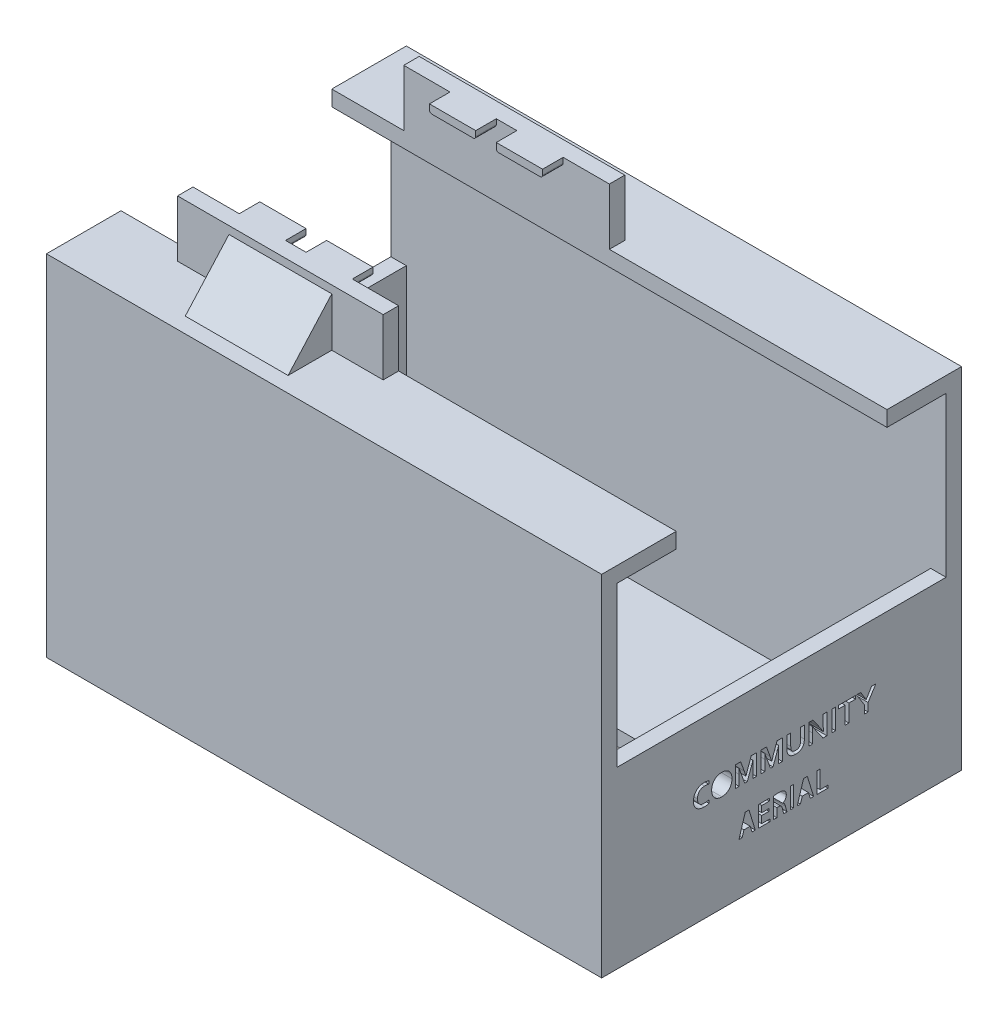
from build123d import *

# Parameters (mm, degrees)
CROQUIS1_W              = 40
CROQUIS1_H              = 47
CROQUIS1_W_2            = 15
CROQUIS1_H_2            = 41
SALIENTE_EXTRUIR1_DEPTH = 3
CROQUIS3_W              = 40
CROQUIS3_H              = 3
SALIENTE_EXTRUIR2_DEPTH = 5
SALIENTE_EXTRUIR3_DEPTH = 4
CROQUIS6_W              = 40
CROQUIS6_H              = 3
SALIENTE_EXTRUIR4_DEPTH = 3
SALIENTE_EXTRUIR5_DEPTH = 54
CROQUIS9_W              = 3
CROQUIS9_H              = 34
SALIENTE_EXTRUIR6_DEPTH = 34
CROQUIS10_W             = 41
CROQUIS10_H             = 6
CORTAR_EXTRUIR1_DEPTH   = 34
NERVIO1_REACH           = 110.361
CROQUIS11_WALL_W        = 231.468567608
CROQUIS11_WALL_H        = 20
CROQUIS12_W             = 60
CROQUIS12_H             = 11
CORTAR_EXTRUIR2_DEPTH   = 68
CROQUIS13_W             = 0.732394367
CROQUIS13_H             = 4
CROQUIS13_W_2           = 0.61236876
CORTAR_EXTRUIR4_DEPTH   = 4
CROQUIS14_R             = 1.733929614
CROQUIS14_R_2           = 0.97438497
CORTAR_EXTRUIR5_DEPTH   = 4


with BuildPart() as part:
    # Croquis1 → Saliente-Extruir1 (new body)
    with BuildSketch(Plane(origin=(0, 0, 0), x_dir=(1, 0, 0), z_dir=(0, 1, 0))):
        Rectangle(CROQUIS1_W, CROQUIS1_H)
        with Locations((-9.5, 0)):
            Rectangle(CROQUIS1_W_2, CROQUIS1_H_2, mode=Mode.SUBTRACT)
        with Locations((9.5, 0)):
            Rectangle(CROQUIS1_W_2, CROQUIS1_H_2, mode=Mode.SUBTRACT)
    extrude(amount=SALIENTE_EXTRUIR1_DEPTH)

    # Croquis3 → Saliente-Extruir2 (add)
    with BuildSketch(Plane(origin=(0, 3, 0), x_dir=(1, 0, 0), z_dir=(0, 1, 0))):
        with Locations((0, 22)):
            Rectangle(CROQUIS3_W, CROQUIS3_H)
        with Locations((0, -22)):
            Rectangle(CROQUIS3_W, CROQUIS3_H)
    extrude(amount=SALIENTE_EXTRUIR2_DEPTH)

    # Croquis5 → Saliente-Extruir3 (add)
    with BuildSketch(Plane.XY.offset(-20.5)):
        with BuildLine():
            Line((-10.5, 6.5), (-2.5, 6.5))
            ThreePointArc((-2.5, 6.5), (-2.146446609, 6.646446609), (-2, 7))
            Line((-2, 7), (-2, 8))
            Line((-2, 8), (-11, 8))
            Line((-11, 8), (-11, 7))
            ThreePointArc((-11, 7), (-10.853553391, 6.646446609), (-10.5, 6.5))
        make_face()
        with BuildLine():
            Line((2, 7), (2, 8))
            Line((2, 8), (11, 8))
            Line((11, 8), (11, 7))
            ThreePointArc((11, 7), (10.853553391, 6.646446609), (10.5, 6.5))
            Line((10.5, 6.5), (2.5, 6.5))
            ThreePointArc((2.5, 6.5), (2.146446609, 6.646446609), (2, 7))
        make_face()
    saliente_extruir3 = extrude(amount=SALIENTE_EXTRUIR3_DEPTH)

    # Simetría3: Saliente-Extruir3 across plane
    add(saliente_extruir3.mirror(Plane.XY))

    # Croquis6 → Saliente-Extruir4 (add)
    with BuildSketch(Plane.XZ):
        with Locations((0, 22)):
            Rectangle(CROQUIS6_W, CROQUIS6_H)
        with Locations((0, -22)):
            Rectangle(CROQUIS6_W, CROQUIS6_H)
    extrude(amount=SALIENTE_EXTRUIR4_DEPTH)

    # Croquis8 → Saliente-Extruir5 (add, symmetric)
    with BuildSketch(Plane(origin=(20, 0, 0), x_dir=(0, 0, -1), z_dir=(1, 0, 0))):
        Polygon((-32, -68), (32, -68), (32, -6), (20.5, -6), (20.5, -3), (35, -3), (35, -71), (-35, -71), (-35, -3), (-20.5, -3), (-20.5, -6), (-32, -6), align=None)
    extrude(amount=SALIENTE_EXTRUIR5_DEPTH, both=True)

    # Croquis9 → Saliente-Extruir6 (add, symmetric)
    with BuildSketch(Plane.XY):
        with Locations((-32.5, -54)):
            Rectangle(CROQUIS9_W, CROQUIS9_H)
        with Locations((72.5, -54)):
            Rectangle(CROQUIS9_W, CROQUIS9_H)
    extrude(amount=SALIENTE_EXTRUIR6_DEPTH, both=True)

    # Croquis10 → Cortar-Extruir1 (cut, symmetric)
    with BuildSketch(Plane(origin=(0, 0, 0), x_dir=(0, 0, -1), z_dir=(1, 0, 0))):
        Rectangle(CROQUIS10_W, CROQUIS10_H)
    extrude(amount=CORTAR_EXTRUIR1_DEPTH, both=True, mode=Mode.SUBTRACT)

    # Croquis11 wall → Nervio1 (add, up to next)
    with BuildSketch(Plane(origin=(0, 1.75, 27.75), x_dir=(0, 0.745241313525, -0.66679485947), z_dir=(0, 0.66679485947, 0.745241313525)), mode=Mode.PRIVATE) as nervio1_sk1:
        Rectangle(CROQUIS11_WALL_W, CROQUIS11_WALL_H)
    nervio1_tool1 = extrude(nervio1_sk1.sketch, amount=-NERVIO1_REACH, mode=Mode.PRIVATE) - part.part
    nervio1 = nervio1_tool1.solids().sort_by_distance((0, 1.75, 27.75))[0]
    add(nervio1)

    # Simetría4: Nervio1 across plane
    add(nervio1.mirror(Plane.XY))

    # Croquis12 → Cortar-Extruir2 (cut)
    with BuildSketch(Plane.XZ.offset(71)):
        with Locations((41, 0)):
            Rectangle(CROQUIS12_W, CROQUIS12_H)
    extrude(amount=-CORTAR_EXTRUIR2_DEPTH, mode=Mode.SUBTRACT)

    # Croquis13 → Cortar-Extruir4 (cut)
    # profile 1 of 15: a face of its own
    with BuildSketch(Plane(origin=(74, 0, 0), x_dir=(0, 0, -1), z_dir=(1, 0, 0))):
        with BuildLine():
            add(Edge.make_bspline(
                [(-15.00528169, -48.663980677), (-15.053765048, -48.665095606), (-15.149332112, -48.667293277), (-15.289739865, -48.686764888), (-15.425107119, -48.7157554), (-15.553314123, -48.759459851), (-15.67476296, -48.813029916), (-15.787922302, -48.878013337), (-15.891314702, -48.955465504), (-15.986458663, -49.042759882), (-16.07089505, -49.142399254), (-16.147179307, -49.251624371), (-16.212352909, -49.372635659), (-16.267957213, -49.503917295), (-16.311743239, -49.645788681), (-16.343268641, -49.797542257), (-16.363129276, -49.958934568), (-16.365157029, -50.070024337), (-16.366197183, -50.127008846)],
                knots=[0, 0, 0, 0, 1.0311898, 2.032610485, 3.011249611, 3.972848753, 4.909243392, 5.832429518, 6.742815144, 7.653029452, 8.57410157, 9.516348602, 10.483103376, 11.493207285, 12.545856977, 13.636989185, 14.787872092, 16, 16, 16, 16], degree=3))
            add(Edge.make_bspline(
                [(-16.366197183, -50.127008846), (-16.364915717, -50.183384183), (-16.362427005, -50.292869736), (-16.346044285, -50.451977108), (-16.31704449, -50.6004457), (-16.276753418, -50.738127731), (-16.225416491, -50.865240928), (-16.163848626, -50.981336445), (-16.093125912, -51.08753053), (-16.011792624, -51.182063329), (-15.920237101, -51.265840018), (-15.818554305, -51.337468246), (-15.708510866, -51.400417198), (-15.588069842, -51.449726174), (-15.459517163, -51.490007217), (-15.321804188, -51.516065145), (-15.176578157, -51.53495803), (-15.076650984, -51.536454512), (-15.025528169, -51.537220114)],
                knots=[0, 0, 0, 0, 1.221355031, 2.371972145, 3.460356745, 4.49426383, 5.475241926, 6.425055258, 7.336592403, 8.233650564, 9.120104613, 10.017973287, 10.92317089, 11.860586024, 12.831793425, 13.836642003, 14.893224465, 16, 16, 16, 16], degree=3))
            add(Edge.make_bspline(
                [(-15.025528169, -51.537220114), (-14.949482973, -51.535822116), (-14.795934247, -51.532999311), (-14.56630306, -51.511329216), (-14.341700538, -51.476991191), (-14.19639141, -51.44167918), (-14.125880282, -51.424544057)],
                knots=[0, 0, 0, 0, 1.003734523, 2.026717865, 3.042466559, 4, 4, 4, 4], degree=3))
            Line((-14.125880282, -51.424544057), (-14.125880282, -52.032818705))
            add(Edge.make_bspline(
                [(-14.125880282, -52.032818705), (-14.197547453, -52.0511587), (-14.345656584, -52.089060582), (-14.577606191, -52.127062811), (-14.821896406, -52.152878899), (-14.988486495, -52.155571437), (-15.07306338, -52.156938423)],
                knots=[0, 0, 0, 0, 0.926191764, 1.91409057, 2.940995081, 4, 4, 4, 4], degree=3))
            add(Edge.make_bspline(
                [(-15.07306338, -52.156938423), (-15.154719597, -52.15543498), (-15.313527623, -52.152511028), (-15.544123458, -52.124523309), (-15.759918117, -52.080195269), (-15.960615959, -52.01796667), (-16.145855315, -51.937703738), (-16.317461435, -51.843968225), (-16.474010961, -51.733861382), (-16.616603503, -51.610618885), (-16.74322833, -51.472312481), (-16.853356857, -51.320805466), (-16.946649023, -51.15591068), (-17.023015887, -50.979132345), (-17.081777498, -50.790739091), (-17.123803062, -50.592709969), (-17.149900656, -50.385332195), (-17.153233858, -50.243870094), (-17.154929577, -50.171903212)],
                knots=[0, 0, 0, 0, 1.203896936, 2.341383232, 3.420178077, 4.449513245, 5.434315283, 6.393137568, 7.328425671, 8.251782613, 9.167644552, 10.087831718, 11.008436049, 11.956305619, 12.92264827, 13.914075026, 14.938814599, 16, 16, 16, 16], degree=3))
            add(Edge.make_bspline(
                [(-17.154929577, -50.171903212), (-17.153372492, -50.097577062), (-17.150302821, -49.95104894), (-17.12199884, -49.735754204), (-17.077475157, -49.52849642), (-17.01425923, -49.330263646), (-16.932810382, -49.142979388), (-16.837563394, -48.966472435), (-16.723390893, -48.804916389), (-16.595827541, -48.655086041), (-16.451596158, -48.520079042), (-16.292584247, -48.399966657), (-16.118435224, -48.295350976), (-15.929901211, -48.206991686), (-15.727996248, -48.133549572), (-15.511860645, -48.083812214), (-15.283572163, -48.050872326), (-15.126880717, -48.046500656), (-15.04665493, -48.044262367)],
                knots=[0, 0, 0, 0, 1.059894444, 2.089497999, 3.092025576, 4.080932083, 5.052173973, 6.00197103, 6.93680796, 7.868951195, 8.804771686, 9.749147683, 10.706826702, 11.69739744, 12.715603198, 13.76545606, 14.855916819, 16, 16, 16, 16], degree=3))
            add(Edge.make_bspline(
                [(-15.04665493, -48.044262367), (-14.964712717, -48.045518719), (-14.804807937, -48.047970408), (-14.608766059, -48.070489752), (-14.459948529, -48.095064168), (-14.355287609, -48.117515022), (-14.255545645, -48.141088495), (-14.192073973, -48.161795502), (-14.161091549, -48.171903212)],
                knots=[0, 0, 0, 0, 1.64119676, 3.202686367, 3.947906341, 4.662823888, 5.347284284, 6, 6, 6, 6], degree=3))
            Line((-14.161091549, -48.171903212), (-14.161091549, -48.776656733))
            add(Edge.make_bspline(
                [(-14.161091549, -48.776656733), (-14.237440794, -48.757912369), (-14.383671924, -48.722011431), (-14.599528289, -48.688115596), (-14.804744013, -48.667442167), (-14.938919229, -48.665126162), (-15.00528169, -48.663980677)],
                knots=[0, 0, 0, 0, 1.104261353, 2.114983396, 3.067679218, 4, 4, 4, 4], degree=3))
        make_face()
    # profile 2 of 15: a face of its own
    with BuildSketch(Plane(origin=(74, 0, 0), x_dir=(0, 0, -1), z_dir=(1, 0, 0))):
        with BuildLine():
            add(Edge.make_bspline(
                [(-9.661971831, -50.100600395), (-9.663358925, -50.17461688), (-9.666080637, -50.31984971), (-9.69147971, -50.533035135), (-9.732340497, -50.736980512), (-9.790671482, -50.930680397), (-9.86332221, -51.113394587), (-9.951795674, -51.283768491), (-10.055763784, -51.440907106), (-10.17523592, -51.584488403), (-10.309581705, -51.713097955), (-10.457753596, -51.828205375), (-10.621409602, -51.926137768), (-10.798053908, -52.010667745), (-10.988751052, -52.076669716), (-11.192752602, -52.12281777), (-11.409101189, -52.151540728), (-11.557713281, -52.15511063), (-11.633802817, -52.156938423)],
                knots=[0, 0, 0, 0, 1.10397319, 2.166181668, 3.19823321, 4.203814349, 5.180208902, 6.127974338, 7.062953007, 7.986182927, 8.908904057, 9.832766977, 10.779571297, 11.748942224, 12.749986143, 13.783327641, 14.865061606, 16, 16, 16, 16], degree=3))
            add(Edge.make_bspline(
                [(-11.633802817, -52.156938423), (-11.709892615, -52.155111039), (-11.85850522, -52.151541934), (-12.074850157, -52.122813293), (-12.278864708, -52.076685483), (-12.469515662, -52.010611594), (-12.646097944, -51.926446323), (-12.809163426, -51.827633775), (-12.957989331, -51.713442005), (-13.092339795, -51.584441684), (-13.211828127, -51.440911473), (-13.315896942, -51.283799009), (-13.403990663, -51.113166875), (-13.478323714, -50.931063716), (-13.534899741, -50.736776242), (-13.576232151, -50.533069095), (-13.601496887, -50.319840724), (-13.604237219, -50.174613846), (-13.605633803, -50.100600395)],
                knots=[0, 0, 0, 0, 1.13493026, 2.216656473, 3.249990565, 4.25102731, 5.22039129, 6.163446387, 7.090771268, 8.013485786, 8.936709089, 9.871681058, 10.819439701, 11.79746504, 12.80178971, 13.833833857, 14.896034721, 16, 16, 16, 16], degree=3))
            add(Edge.make_bspline(
                [(-13.605633803, -50.100600395), (-13.604215828, -50.026589873), (-13.601427936, -49.881077188), (-13.576423694, -49.667805709), (-13.534758554, -49.464159624), (-13.47833935, -49.270134116), (-13.403986703, -49.088034588), (-13.315897824, -48.91740191), (-13.211828442, -48.760288174), (-13.092337701, -48.616763495), (-12.957997416, -48.48774233), (-12.809132796, -48.373629229), (-12.646323097, -48.274580414), (-12.469286956, -48.191622682), (-12.278768844, -48.12559336), (-12.074980093, -48.078099494), (-11.85848801, -48.049738773), (-11.709886787, -48.046116814), (-11.633802817, -48.044262367)],
                knots=[0, 0, 0, 0, 1.104021813, 2.170626186, 3.19843321, 4.202809312, 5.180884735, 6.128691913, 7.063711762, 7.986982344, 8.909744114, 9.837116483, 10.780219874, 11.74776306, 12.748851068, 13.783230012, 14.86501162, 16, 16, 16, 16], degree=3))
            add(Edge.make_bspline(
                [(-11.633802817, -48.044262367), (-11.55771911, -48.046117223), (-11.4091184, -48.049739981), (-11.192622659, -48.078095007), (-10.988846944, -48.125609176), (-10.798282587, -48.191566462), (-10.621183648, -48.274887471), (-10.457784122, -48.37305743), (-10.30957364, -48.488086418), (-10.175238014, -48.616716772), (-10.055763467, -48.760292541), (-9.951794803, -48.917432431), (-9.863326123, -49.087806862), (-9.790656041, -49.270517494), (-9.732483604, -49.463955956), (-9.691288479, -49.667839767), (-9.666149545, -49.881068188), (-9.663380314, -50.026586839), (-9.661971831, -50.100600395)],
                knots=[0, 0, 0, 0, 1.134996515, 2.216785876, 3.251172233, 4.252267416, 5.219817536, 6.166670343, 7.090580574, 8.013348957, 8.936626156, 9.871652706, 10.819466677, 11.795911232, 12.801543866, 13.829358257, 14.895970275, 16, 16, 16, 16], degree=3))
        make_face()
        with BuildLine():
            add(Edge.make_bspline(
                [(-10.450704225, -50.100600395), (-10.451581184, -50.042458453), (-10.453281454, -49.929731274), (-10.470289774, -49.766078078), (-10.497961808, -49.613800818), (-10.536956689, -49.472818541), (-10.585128958, -49.343116608), (-10.642666695, -49.224373147), (-10.708151704, -49.116334017), (-10.783985113, -49.020998424), (-10.865852214, -48.935555074), (-10.955949409, -48.862103846), (-11.054096725, -48.800907541), (-11.158894812, -48.750645609), (-11.270400991, -48.712168737), (-11.386768365, -48.683936154), (-11.508576471, -48.666644982), (-11.591491788, -48.664880883), (-11.633802817, -48.663980677)],
                knots=[0, 0, 0, 0, 1.326027526, 2.570938252, 3.748651103, 4.853004742, 5.903648558, 6.900610549, 7.859261004, 8.779270952, 9.673995906, 10.554280722, 11.42350071, 12.306758397, 13.200155178, 14.109361998, 15.035222432, 16, 16, 16, 16], degree=3))
            add(Edge.make_bspline(
                [(-11.633802817, -48.663980677), (-11.676113817, -48.664880909), (-11.759029079, -48.66664506), (-11.880837586, -48.683935859), (-11.997203482, -48.712169816), (-12.108715054, -48.750641672), (-12.21349341, -48.800921958), (-12.311713373, -48.862050684), (-12.401694142, -48.935887993), (-12.484611047, -49.020390945), (-12.559297196, -49.116694435), (-12.625010312, -49.224314651), (-12.682456105, -49.343133467), (-12.730654886, -49.472813672), (-12.769642084, -49.613802246), (-12.797316366, -49.766077663), (-12.81432404, -49.929731388), (-12.816024403, -50.042458492), (-12.816901408, -50.100600395)],
                knots=[0, 0, 0, 0, 0.964744669, 1.890573531, 2.799749348, 3.693115665, 4.576343233, 5.44553358, 6.325788378, 7.225153193, 8.141006995, 9.09962476, 10.096552755, 11.147160744, 12.251476725, 13.429149416, 14.674017691, 16, 16, 16, 16], degree=3))
            add(Edge.make_bspline(
                [(-12.816901408, -50.100600395), (-12.816021989, -50.158741667), (-12.814316948, -50.271467546), (-12.797342134, -50.435129872), (-12.769502614, -50.587653899), (-12.730796658, -50.729010134), (-12.682624197, -50.858732926), (-12.625042468, -50.976941423), (-12.558996672, -51.083715843), (-12.484924308, -51.179928432), (-12.401416362, -51.263603466), (-12.311474848, -51.337265072), (-12.213800418, -51.399649172), (-12.108467691, -51.449276719), (-11.997558105, -51.489670408), (-11.880582413, -51.515709689), (-11.759141661, -51.534964653), (-11.67613787, -51.536458298), (-11.633802817, -51.537220114)],
                knots=[0, 0, 0, 0, 1.326383379, 2.571628189, 3.749657091, 4.860761826, 5.911687593, 6.902896967, 7.856106969, 8.77223779, 9.667102655, 10.547623704, 11.420653433, 12.304148151, 13.200014488, 14.107911086, 15.034963524, 16, 16, 16, 16], degree=3))
            add(Edge.make_bspline(
                [(-11.633802817, -51.537220114), (-11.591467735, -51.536458325), (-11.508463889, -51.534964731), (-11.387023538, -51.515709392), (-11.270046372, -51.489671493), (-11.159142177, -51.449272747), (-11.053789726, -51.399663702), (-10.95618807, -51.337211338), (-10.866131853, -51.263937582), (-10.783668618, -51.179320665), (-10.708454614, -51.084074839), (-10.64263391, -50.976883326), (-10.584960914, -50.85874978), (-10.536814957, -50.729005221), (-10.498101273, -50.587655333), (-10.470264007, -50.435129456), (-10.453288547, -50.271467661), (-10.451583597, -50.158741706), (-10.450704225, -50.100600395)],
                knots=[0, 0, 0, 0, 0.965070905, 1.892156417, 2.800085406, 3.695983705, 4.579509943, 5.452570818, 6.333123281, 7.223323078, 8.143612752, 9.096856762, 10.088101498, 11.139064759, 12.250209134, 13.428280064, 14.6735693, 16, 16, 16, 16], degree=3))
        make_face(mode=Mode.SUBTRACT)
    # profile 3 of 15: a face of its own
    with BuildSketch(Plane(origin=(74, 0, 0), x_dir=(0, 0, -1), z_dir=(1, 0, 0))):
        with BuildLine():
            add(Edge.make_bspline(
                [(-6.923415493, -51.027537015), (-6.900658399, -50.947304259), (-6.854146156, -50.783319987), (-6.774789588, -50.534643353), (-6.690135389, -50.276637523), (-6.628306929, -50.102820456), (-6.596830986, -50.01433279)],
                knots=[0, 0, 0, 0, 0.939842652, 1.920903895, 2.941563291, 4, 4, 4, 4], degree=3))
            Line((-6.596830986, -50.01433279), (-5.904049296, -48.100600395))
            Line((-5.904049296, -48.100600395), (-4.873239437, -48.100600395))
            Line((-4.873239437, -48.100600395), (-4.873239437, -52.100600395))
            Line((-4.873239437, -52.100600395), (-5.605633803, -52.100600395))
            Line((-5.605633803, -52.100600395), (-5.605633803, -50.073311663))
            add(Edge.make_bspline(
                [(-5.605633803, -50.073311663), (-5.604936021, -49.996138108), (-5.603484561, -49.835608965), (-5.597539397, -49.585843989), (-5.585512756, -49.318258343), (-5.575559039, -49.134042952), (-5.570422535, -49.038980677)],
                knots=[0, 0, 0, 0, 0.894747737, 1.861169783, 2.896280781, 4, 4, 4, 4], degree=3))
            Line((-5.570422535, -49.038980677), (-5.596830986, -49.038980677))
            add(Edge.make_bspline(
                [(-5.596830986, -49.038980677), (-5.615102353, -49.099493986), (-5.653786008, -49.227611163), (-5.718326113, -49.42512224), (-5.786919341, -49.632032922), (-5.83631121, -49.770874074), (-5.860915493, -49.840037015)],
                knots=[0, 0, 0, 0, 0.899185574, 1.903731904, 2.955755803, 4, 4, 4, 4], degree=3))
            Line((-5.860915493, -49.840037015), (-6.69278169, -52.100600395))
            Line((-6.69278169, -52.100600395), (-7.166373239, -52.100600395))
            Line((-7.166373239, -52.100600395), (-7.998239437, -49.840037015))
            add(Edge.make_bspline(
                [(-7.998239437, -49.840037015), (-8.02272897, -49.770835829), (-8.071921732, -49.631829607), (-8.142226031, -49.425484971), (-8.205099781, -49.22742969), (-8.243957877, -49.099463295), (-8.262323944, -49.038980677)],
                knots=[0, 0, 0, 0, 1.044229383, 2.097570722, 3.100827182, 4, 4, 4, 4], degree=3))
            Line((-8.262323944, -49.038980677), (-8.289612676, -49.038980677))
            add(Edge.make_bspline(
                [(-8.289612676, -49.038980677), (-8.284076543, -49.1296353), (-8.273205323, -49.307652411), (-8.261519975, -49.570290444), (-8.255590149, -49.823577773), (-8.254201736, -49.989389068), (-8.253521127, -50.070670818)],
                knots=[0, 0, 0, 0, 1.055577018, 2.072820593, 3.055284423, 4, 4, 4, 4], degree=3))
            Line((-8.253521127, -50.070670818), (-8.253521127, -52.100600395))
            Line((-8.253521127, -52.100600395), (-8.985915493, -52.100600395))
            Line((-8.985915493, -52.100600395), (-8.985915493, -48.100600395))
            Line((-8.985915493, -48.100600395), (-7.960387324, -48.100600395))
            Line((-7.960387324, -48.100600395), (-7.268485915, -50.004649691))
            add(Edge.make_bspline(
                [(-7.268485915, -50.004649691), (-7.239760001, -50.085249964), (-7.181440259, -50.248885739), (-7.097576939, -50.499852108), (-7.017711519, -50.760357558), (-6.967404524, -50.93765575), (-6.941901408, -51.027537015)],
                knots=[0, 0, 0, 0, 0.956008945, 1.940902413, 2.956141108, 4, 4, 4, 4], degree=3))
            Line((-6.941901408, -51.027537015), (-6.923415493, -51.027537015))
        make_face()
    # profile 4 of 15: a face of its own
    with BuildSketch(Plane(origin=(74, 0, 0), x_dir=(0, 0, -1), z_dir=(1, 0, 0))):
        with BuildLine():
            add(Edge.make_bspline(
                [(-1.909330986, -51.027537015), (-1.886573892, -50.947304259), (-1.840061649, -50.783319987), (-1.760705081, -50.534643353), (-1.676050882, -50.276637523), (-1.614222422, -50.102820456), (-1.582746479, -50.01433279)],
                knots=[0, 0, 0, 0, 0.939842652, 1.920903895, 2.941563291, 4, 4, 4, 4], degree=3))
            Line((-1.582746479, -50.01433279), (-0.889964789, -48.100600395))
            Line((-0.889964789, -48.100600395), (0.14084507, -48.100600395))
            Line((0.14084507, -48.100600395), (0.14084507, -52.100600395))
            Line((0.14084507, -52.100600395), (-0.591549296, -52.100600395))
            Line((-0.591549296, -52.100600395), (-0.591549296, -50.073311663))
            add(Edge.make_bspline(
                [(-0.591549296, -50.073311663), (-0.590851514, -49.996138108), (-0.589400054, -49.835608965), (-0.58345489, -49.585843989), (-0.571428249, -49.318258343), (-0.561474532, -49.134042952), (-0.556338028, -49.038980677)],
                knots=[0, 0, 0, 0, 0.894747737, 1.861169783, 2.896280781, 4, 4, 4, 4], degree=3))
            Line((-0.556338028, -49.038980677), (-0.582746479, -49.038980677))
            add(Edge.make_bspline(
                [(-0.582746479, -49.038980677), (-0.601017846, -49.099493986), (-0.639701501, -49.227611163), (-0.704241606, -49.42512224), (-0.772834834, -49.632032922), (-0.822226703, -49.770874074), (-0.846830986, -49.840037015)],
                knots=[0, 0, 0, 0, 0.899185574, 1.903731904, 2.955755803, 4, 4, 4, 4], degree=3))
            Line((-0.846830986, -49.840037015), (-1.678697183, -52.100600395))
            Line((-1.678697183, -52.100600395), (-2.152288732, -52.100600395))
            Line((-2.152288732, -52.100600395), (-2.98415493, -49.840037015))
            add(Edge.make_bspline(
                [(-2.98415493, -49.840037015), (-3.008644463, -49.770835829), (-3.057837225, -49.631829607), (-3.128141524, -49.425484971), (-3.191015274, -49.22742969), (-3.22987337, -49.099463295), (-3.248239437, -49.038980677)],
                knots=[0, 0, 0, 0, 1.044229383, 2.097570722, 3.100827182, 4, 4, 4, 4], degree=3))
            Line((-3.248239437, -49.038980677), (-3.275528169, -49.038980677))
            add(Edge.make_bspline(
                [(-3.275528169, -49.038980677), (-3.269992036, -49.1296353), (-3.259120816, -49.307652411), (-3.247435468, -49.570290444), (-3.241505642, -49.823577773), (-3.240117229, -49.989389068), (-3.23943662, -50.070670818)],
                knots=[0, 0, 0, 0, 1.055577018, 2.072820593, 3.055284423, 4, 4, 4, 4], degree=3))
            Line((-3.23943662, -50.070670818), (-3.23943662, -52.100600395))
            Line((-3.23943662, -52.100600395), (-3.971830986, -52.100600395))
            Line((-3.971830986, -52.100600395), (-3.971830986, -48.100600395))
            Line((-3.971830986, -48.100600395), (-2.946302817, -48.100600395))
            Line((-2.946302817, -48.100600395), (-2.254401408, -50.004649691))
            add(Edge.make_bspline(
                [(-2.254401408, -50.004649691), (-2.225675494, -50.085249964), (-2.167355752, -50.248885739), (-2.083492432, -50.499852108), (-2.003627012, -50.760357558), (-1.953320017, -50.93765575), (-1.927816901, -51.027537015)],
                knots=[0, 0, 0, 0, 0.956008945, 1.940902413, 2.956141108, 4, 4, 4, 4], degree=3))
            Line((-1.927816901, -51.027537015), (-1.909330986, -51.027537015))
        make_face()
    # profile 5 of 15: a face of its own
    with BuildSketch(Plane(origin=(74, 0, 0), x_dir=(0, 0, -1), z_dir=(1, 0, 0))):
        with BuildLine():
            add(Edge.make_bspline(
                [(2.723591549, -52.156938423), (2.672221142, -52.156355038), (2.5719858, -52.15521672), (2.425570952, -52.143677845), (2.287193716, -52.124209051), (2.156396044, -52.098412153), (2.033790148, -52.063409917), (1.918079996, -52.023618443), (1.810413919, -51.975482085), (1.709442511, -51.922347541), (1.617118383, -51.860872884), (1.530723694, -51.794954379), (1.452403775, -51.721482427), (1.380748699, -51.642043755), (1.316491331, -51.556440179), (1.259060573, -51.465052523), (1.207804595, -51.368651429), (1.179636125, -51.300960644), (1.165492958, -51.266973635)],
                knots=[0, 0, 0, 0, 1.284149377, 2.505667333, 3.668684817, 4.776505819, 5.835598029, 6.854151427, 7.832906619, 8.781419536, 9.703141904, 10.602642284, 11.495416435, 12.383688235, 13.274289595, 14.167786835, 15.080060207, 16, 16, 16, 16], degree=3))
            add(Edge.make_bspline(
                [(1.165492958, -51.266973635), (1.145316334, -51.208981471), (1.103484517, -51.088747407), (1.073142257, -50.928977667), (1.057197266, -50.792124873), (1.048629145, -50.681993393), (1.043172837, -50.565738264), (1.042565859, -50.486463792), (1.042253521, -50.445670818)],
                knots=[0, 0, 0, 0, 1.32195239, 2.740779095, 3.492241663, 4.291567828, 5.120876772, 6, 6, 6, 6], degree=3))
            Line((1.042253521, -50.445670818), (1.042253521, -48.100600395))
            Line((1.042253521, -48.100600395), (1.774647887, -48.100600395))
            Line((1.774647887, -48.100600395), (1.774647887, -50.377889128))
            add(Edge.make_bspline(
                [(1.774647887, -50.377889128), (1.775051584, -50.411930359), (1.775838433, -50.478280596), (1.780039638, -50.575198897), (1.787864333, -50.66654742), (1.799068519, -50.752084261), (1.814321664, -50.831596654), (1.831589083, -50.905797057), (1.852443563, -50.974355634), (1.869444897, -51.017366066), (1.877640845, -51.038100395)],
                knots=[0, 0, 0, 0, 1.215006037, 2.368185182, 3.461409746, 4.486337662, 5.445541711, 6.349834058, 7.204493354, 8, 8, 8, 8], degree=3))
            add(Edge.make_bspline(
                [(1.877640845, -51.038100395), (1.897730687, -51.079946455), (1.936474556, -51.160647851), (2.015204352, -51.266652134), (2.10597188, -51.354979191), (2.211344334, -51.423750227), (2.327944697, -51.474104276), (2.454073945, -51.511440337), (2.590182615, -51.533590759), (2.684190055, -51.535989902), (2.732394366, -51.537220114)],
                knots=[0, 0, 0, 0, 1.053490555, 2.031688479, 2.984922908, 3.919479452, 4.875395605, 5.863442889, 6.90443497, 8, 8, 8, 8], degree=3))
            add(Edge.make_bspline(
                [(2.732394366, -51.537220114), (2.780596638, -51.535981499), (2.874600101, -51.533565968), (3.010458291, -51.511576902), (3.136230352, -51.473963142), (3.252690385, -51.423509592), (3.358727833, -51.355283858), (3.44956022, -51.266615595), (3.528320832, -51.160657917), (3.567060318, -51.079949893), (3.587147887, -51.038100395)],
                knots=[0, 0, 0, 0, 1.095676754, 2.136774994, 3.118525873, 4.074539509, 5.014772694, 5.968104333, 6.946402012, 8, 8, 8, 8], degree=3))
            add(Edge.make_bspline(
                [(3.587147887, -51.038100395), (3.595343835, -51.017366066), (3.612345169, -50.974355634), (3.63319965, -50.905797057), (3.650467068, -50.831596654), (3.665720213, -50.752084261), (3.6769244, -50.66654742), (3.684749094, -50.575198897), (3.688950299, -50.478280596), (3.689737149, -50.411930359), (3.690140845, -50.377889128)],
                knots=[0, 0, 0, 0, 0.795506646, 1.650165942, 2.554458289, 3.513662338, 4.538590254, 5.631814818, 6.784993963, 8, 8, 8, 8], degree=3))
            Line((3.690140845, -50.377889128), (3.690140845, -48.100600395))
            Line((3.690140845, -48.100600395), (4.422535211, -48.100600395))
            Line((4.422535211, -48.100600395), (4.422535211, -50.445670818))
            add(Edge.make_bspline(
                [(4.422535211, -50.445670818), (4.422193173, -50.486461413), (4.421528477, -50.565731262), (4.416480323, -50.68204352), (4.406455425, -50.792082793), (4.390772653, -50.928903549), (4.3615308, -51.088854886), (4.319552242, -51.208998939), (4.299295775, -51.266973635)],
                knots=[0, 0, 0, 0, 0.879226023, 1.708631938, 2.508576804, 3.260127239, 4.677893034, 6, 6, 6, 6], degree=3))
            add(Edge.make_bspline(
                [(4.299295775, -51.266973635), (4.285136847, -51.300950959), (4.256936986, -51.368622455), (4.20583964, -51.465305745), (4.147348006, -51.55643493), (4.082279792, -51.64208085), (4.009701865, -51.721476891), (3.930420229, -51.7952104), (3.842211046, -51.861138231), (3.7474971, -51.922069178), (3.644495346, -51.975756443), (3.53454689, -52.0233852), (3.416916388, -52.063456451), (3.292792949, -52.098271748), (3.160872003, -52.124234194), (3.02189558, -52.143610957), (2.87519906, -52.155228597), (2.774962553, -52.156359062), (2.723591549, -52.156938423)],
                knots=[0, 0, 0, 0, 0.912844519, 1.818081747, 2.708593891, 3.596722591, 4.48302961, 5.374255543, 6.278379858, 7.211320848, 8.165379651, 9.1565951, 10.181040717, 11.245989362, 12.352401358, 13.513658274, 14.725754957, 16, 16, 16, 16], degree=3))
        make_face()
    # profile 6 of 15: a face of its own
    with BuildSketch(Plane(origin=(74, 0, 0), x_dir=(0, 0, -1), z_dir=(1, 0, 0))):
        with BuildLine():
            add(Edge.make_bspline(
                [(7.404049296, -49.960635607), (7.43895331, -50.011113783), (7.507463362, -50.110193003), (7.608608525, -50.255980726), (7.702318964, -50.399023883), (7.792147694, -50.537200489), (7.877818232, -50.670471589), (7.95703175, -50.800558035), (8.031716636, -50.925774304), (8.079046462, -51.008397379), (8.102112676, -51.048663776)],
                knots=[0, 0, 0, 0, 1.13896322, 2.235571772, 3.292817263, 4.312366223, 5.294281487, 6.232900844, 7.138803343, 8, 8, 8, 8], degree=3))
            Line((8.102112676, -51.048663776), (8.11971831, -51.048663776))
            add(Edge.make_bspline(
                [(8.11971831, -51.048663776), (8.117055446, -50.985871291), (8.111916556, -50.864692113), (8.104844071, -50.689516566), (8.098771426, -50.527541756), (8.093117052, -50.378793528), (8.089848821, -50.243211101), (8.087143488, -50.12114639), (8.085276968, -50.012283738), (8.084753139, -49.944204221), (8.084507042, -49.912220114)],
                knots=[0, 0, 0, 0, 1.326562248, 2.560047207, 3.700459796, 4.747806249, 5.701913724, 6.562998787, 7.324889438, 8, 8, 8, 8], degree=3))
            Line((8.084507042, -49.912220114), (8.084507042, -48.100600395))
            Line((8.084507042, -48.100600395), (8.816901408, -48.100600395))
            Line((8.816901408, -48.100600395), (8.816901408, -52.100600395))
            Line((8.816901408, -52.100600395), (8.050176056, -52.100600395))
            Line((8.050176056, -52.100600395), (6.749119718, -50.259051099))
            add(Edge.make_bspline(
                [(6.749119718, -50.259051099), (6.690772111, -50.176674435), (6.570560683, -50.006956822), (6.395995948, -49.738221445), (6.216230976, -49.451643298), (6.098975862, -49.252309908), (6.038732394, -49.14989617)],
                knots=[0, 0, 0, 0, 0.919269384, 1.893936901, 2.917944486, 4, 4, 4, 4], degree=3))
            Line((6.038732394, -49.14989617), (6.020246479, -49.14989617))
            add(Edge.make_bspline(
                [(6.020246479, -49.14989617), (6.023290338, -49.20945683), (6.029197164, -49.325038526), (6.035986422, -49.493198976), (6.042156333, -49.651061789), (6.04776477, -49.79863866), (6.051027708, -49.935982056), (6.053745507, -50.062741689), (6.055588239, -50.179234165), (6.056095456, -50.253475463), (6.056338028, -50.288980677)],
                knots=[0, 0, 0, 0, 1.255808074, 2.436984887, 3.543827291, 4.582519822, 5.546722309, 6.436656003, 7.252345191, 8, 8, 8, 8], degree=3))
            Line((6.056338028, -50.288980677), (6.056338028, -52.100600395))
            Line((6.056338028, -52.100600395), (5.323943662, -52.100600395))
            Line((5.323943662, -52.100600395), (5.323943662, -48.100600395))
            Line((5.323943662, -48.100600395), (6.090669014, -48.100600395))
            Line((6.090669014, -48.100600395), (7.404049296, -49.960635607))
        make_face()
    # profile 7 of 15: a face of its own
    with BuildSketch(Plane(origin=(74, 0, 0), x_dir=(0, 0, -1), z_dir=(1, 0, 0))):
        with Locations((10.14084507, -50.100600395)):
            Rectangle(CROQUIS13_W, CROQUIS13_H)
    # profile 8 of 15: a face of its own
    with BuildSketch(Plane(origin=(74, 0, 0), x_dir=(0, 0, -1), z_dir=(1, 0, 0))):
        Polygon((13.098591549, -52.100600395), (12.366197183, -52.100600395), (12.366197183, -48.720318705), (11.082746479, -48.720318705), (11.082746479, -48.100600395), (14.379401408, -48.100600395), (14.379401408, -48.720318705), (13.098591549, -48.720318705), align=None)
    # profile 9 of 15: a face of its own
    with BuildSketch(Plane(origin=(74, 0, 0), x_dir=(0, 0, -1), z_dir=(1, 0, 0))):
        Polygon((16.455105634, -49.822431381), (17.514964789, -48.100600395), (18.32306338, -48.100600395), (16.816901408, -50.488804621), (16.816901408, -52.100600395), (16.084507042, -52.100600395), (16.084507042, -50.488804621), (14.57834507, -48.100600395), (15.386443662, -48.100600395), (16.446302817, -49.822431381), align=None)
    # profile 10 of 15: a face of its own
    with BuildSketch(Plane(origin=(74, 0, 0), x_dir=(0, 0, -1), z_dir=(1, 0, 0))):
        Polygon((-6.338925369, -57.032247657), (-7.079031598, -57.032247657), (-8.29864327, -61.032247657), (-7.678413403, -61.032247657), (-7.334420367, -59.872746131), (-6.114808694, -59.872746131), (-5.755179611, -61.032247657), (-5.119156091, -61.032247657), align=None)
        with BuildLine():
            Line((-7.240604084, -59.398385684), (-6.922671127, -58.343813074))
            add(Edge.make_bspline(
                [(-6.922671127, -58.343813074), (-6.906008588, -58.27947654), (-6.872041028, -58.148322752), (-6.824695308, -57.949544458), (-6.779768305, -57.750954597), (-6.749888792, -57.619724808), (-6.735294118, -57.555625503)],
                knots=[0, 0, 0, 0, 0.984318571, 2.006591001, 3.026317632, 4, 4, 4, 4], degree=3))
            Line((-6.735294118, -57.555625503), (-6.72461453, -57.555329441))
            add(Edge.make_bspline(
                [(-6.72461453, -57.555329441), (-6.709934213, -57.619053964), (-6.679869028, -57.749561326), (-6.632083595, -57.947302779), (-6.581411923, -58.148016938), (-6.54518982, -58.281669098), (-6.527149321, -58.348234854)],
                knots=[0, 0, 0, 0, 0.960266458, 1.966618773, 2.987269952, 4, 4, 4, 4], degree=3))
            Line((-6.527149321, -58.348234854), (-6.213836992, -59.398385684))
            Line((-6.213836992, -59.398385684), (-7.240604084, -59.398385684))
        make_face(mode=Mode.SUBTRACT)
    # profile 11 of 15: a face of its own
    with BuildSketch(Plane(origin=(74, 0, 0), x_dir=(0, 0, -1), z_dir=(1, 0, 0))):
        Polygon((-2.299739878, -60.556755988), (-3.868778281, -60.556755988), (-3.868778281, -59.197029691), (-2.471760699, -59.197029691), (-2.471760699, -58.722669243), (-3.868778281, -58.722669243), (-3.868778281, -57.507739326), (-2.388356665, -57.507739326), (-2.388356665, -57.033378879), (-4.481147041, -57.033378879), (-4.481147041, -61.031116435), (-2.299739878, -61.031116435), align=None)
    # profile 12 of 15: a face of its own
    with BuildSketch(Plane(origin=(74, 0, 0), x_dir=(0, 0, -1), z_dir=(1, 0, 0))):
        with BuildLine():
            add(Edge.make_bspline(
                [(0.187456548, -59.13617718), (0.212848064, -59.126778371), (0.263242591, -59.10812456), (0.33600675, -59.073927912), (0.405328784, -59.034480346), (0.471749855, -58.991174429), (0.533855528, -58.942238), (0.593083753, -58.889360981), (0.648711127, -58.831300625), (0.70081187, -58.768700239), (0.748616501, -58.701757545), (0.789832013, -58.629858498), (0.826101119, -58.554021597), (0.853713992, -58.473217748), (0.878175857, -58.388908594), (0.893689871, -58.299852975), (0.905942037, -58.206778903), (0.90779996, -58.143150035), (0.908748115, -58.110678293)],
                knots=[0, 0, 0, 0, 0.968096788, 1.921381203, 2.871565223, 3.819193376, 4.754456153, 5.696780216, 6.656993399, 7.627465337, 8.607882593, 9.594874389, 10.588356534, 11.60928899, 12.645508482, 13.724758014, 14.838874979, 16, 16, 16, 16], degree=3))
            add(Edge.make_bspline(
                [(0.908748115, -58.110678293), (0.907704725, -58.069407834), (0.90566163, -57.988594799), (0.89052131, -57.870342666), (0.864654921, -57.758045223), (0.829527074, -57.651786312), (0.784522179, -57.552155683), (0.728025523, -57.461562348), (0.663339872, -57.377929411), (0.612292776, -57.330004619), (0.586726998, -57.306002577)],
                knots=[0, 0, 0, 0, 1.108068021, 2.169744176, 3.194822331, 4.198109332, 5.170747843, 6.122429769, 7.059661645, 8, 8, 8, 8], degree=3))
            add(Edge.make_bspline(
                [(0.586726998, -57.306002577), (0.554461395, -57.279428952), (0.488999577, -57.225515262), (0.375963882, -57.16047159), (0.251794775, -57.104369957), (0.114755733, -57.059298834), (-0.034876446, -57.025950279), (-0.196660606, -57.001967436), (-0.371304575, -56.988353173), (-0.491931743, -56.98795702), (-0.554298643, -56.9877522)],
                knots=[0, 0, 0, 0, 0.827221313, 1.678301493, 2.574754406, 3.524835391, 4.531659668, 5.609758117, 6.764192347, 8, 8, 8, 8], degree=3))
            add(Edge.make_bspline(
                [(-0.554298643, -56.9877522), (-0.643812862, -56.98928782), (-0.820240203, -56.992314438), (-1.038045025, -57.006528372), (-1.204941953, -57.024351081), (-1.32223106, -57.037386286), (-1.432337569, -57.05329521), (-1.50329307, -57.065529042), (-1.537707391, -57.071462607)],
                knots=[0, 0, 0, 0, 1.630788357, 3.214189375, 3.973790731, 4.688368382, 5.363841967, 6, 6, 6, 6], degree=3))
            Line((-1.537707391, -57.071462607), (-1.536953979, -61.032247657))
            Line((-1.536953979, -61.032247657), (-0.924585219, -61.032247657))
            Line((-0.924585219, -61.032247657), (-0.924585219, -59.342956556))
            Line((-0.924585219, -59.342956556), (-0.559125483, -59.342956556))
            add(Edge.make_bspline(
                [(-0.559125483, -59.342956556), (-0.533862037, -59.343277603), (-0.484822794, -59.343900792), (-0.41344583, -59.351975161), (-0.346139214, -59.363406751), (-0.283279415, -59.381337292), (-0.225420672, -59.406054787), (-0.17168658, -59.435028538), (-0.122989603, -59.470496287), (-0.077656339, -59.510657923), (-0.037196057, -59.558120844), (0.001338503, -59.611467115), (0.035257125, -59.672592553), (0.067209409, -59.740379689), (0.096268063, -59.814748178), (0.123000622, -59.896243656), (0.145830064, -59.98481831), (0.159093879, -60.046526891), (0.165912519, -60.078249937)],
                knots=[0, 0, 0, 0, 1.055052437, 2.047977695, 2.997799154, 3.905326843, 4.771489458, 5.622359223, 6.450226471, 7.283274999, 8.146886319, 9.050454311, 10.028884349, 11.062585003, 12.180236884, 13.362738737, 14.64424106, 16, 16, 16, 16], degree=3))
            add(Edge.make_bspline(
                [(0.165912519, -60.078249937), (0.178015024, -60.137622512), (0.201178648, -60.251258824), (0.237794891, -60.413517462), (0.271884743, -60.560550375), (0.305921763, -60.69113932), (0.336996702, -60.804142897), (0.365679378, -60.898254583), (0.390961909, -60.972882255), (0.409762001, -61.014998817), (0.417797888, -61.033001068)],
                knots=[0, 0, 0, 0, 1.47058644, 2.814633188, 4.037017584, 5.133550536, 6.089801944, 6.881075586, 7.52172834, 8, 8, 8, 8], degree=3))
            Line((0.417797888, -61.033001068), (1.050245835, -61.032247657))
            add(Edge.make_bspline(
                [(1.050245835, -61.032247657), (1.039666134, -61.009521846), (1.015553996, -60.957727571), (0.984610901, -60.866651995), (0.949790521, -60.755370643), (0.91451287, -60.623760701), (0.876333936, -60.4751812), (0.836909714, -60.311266942), (0.793375763, -60.134293591), (0.765048331, -60.011420451), (0.750377074, -59.947782366)],
                knots=[0, 0, 0, 0, 0.533646052, 1.216229836, 2.046136303, 3.017835667, 4.117877406, 5.314023473, 6.608887153, 8, 8, 8, 8], degree=3))
            add(Edge.make_bspline(
                [(0.750377074, -59.947782366), (0.738483101, -59.896994725), (0.71554253, -59.799037757), (0.667400187, -59.661532257), (0.612782835, -59.537661304), (0.54963169, -59.427845133), (0.476012343, -59.33256585), (0.390676098, -59.253481551), (0.294498305, -59.188842525), (0.223097632, -59.160460691), (0.187028658, -59.14612324)],
                knots=[0, 0, 0, 0, 1.21940983, 2.351944079, 3.402180539, 4.382494675, 5.308257689, 6.20701365, 7.094249724, 8, 8, 8, 8], degree=3))
            Line((0.187028658, -59.14612324), (0.187456548, -59.13617718))
        make_face()
        with BuildLine():
            Line((-0.924585219, -58.914599862), (-0.924585219, -57.4946419))
            add(Edge.make_bspline(
                [(-0.924585219, -57.4946419), (-0.914041289, -57.492038276), (-0.89129291, -57.486420995), (-0.853934719, -57.478541248), (-0.810275092, -57.473042451), (-0.760495404, -57.467762346), (-0.704689822, -57.463089915), (-0.642549391, -57.460459231), (-0.574429134, -57.45791339), (-0.526900891, -57.457697964), (-0.502262443, -57.457586287)],
                knots=[0, 0, 0, 0, 0.613358181, 1.323311631, 2.154488473, 3.096694732, 4.150663235, 5.316138274, 6.608697028, 8, 8, 8, 8], degree=3))
            add(Edge.make_bspline(
                [(-0.502262443, -57.457586287), (-0.474854549, -57.457783886), (-0.421223162, -57.458170545), (-0.342253195, -57.463910359), (-0.266902307, -57.47610446), (-0.194736715, -57.493380207), (-0.126091733, -57.516338484), (-0.06001595, -57.542979919), (0.001877931, -57.576559435), (0.060243552, -57.614985232), (0.114492762, -57.659172902), (0.16133826, -57.711864899), (0.201750513, -57.771372228), (0.235217425, -57.838246136), (0.260152844, -57.91283437), (0.280260326, -57.993935115), (0.291747744, -58.082477477), (0.294801956, -58.143832433), (0.29638009, -58.175535005)],
                knots=[0, 0, 0, 0, 1.074280746, 2.102137624, 3.100083999, 4.063271454, 5.007469707, 5.935276545, 6.852293034, 7.762400579, 8.672081243, 9.58618109, 10.515452006, 11.484970009, 12.507142843, 13.592216131, 14.755879754, 16, 16, 16, 16], degree=3))
            add(Edge.make_bspline(
                [(0.29638009, -58.175535005), (0.295318764, -58.20296793), (0.293246839, -58.256522531), (0.282704894, -58.334588164), (0.26544055, -58.408146679), (0.241179362, -58.477445091), (0.209892259, -58.54239958), (0.173362499, -58.60391229), (0.12871787, -58.660129665), (0.078397761, -58.712163835), (0.021744601, -58.758978266), (-0.040373616, -58.799594296), (-0.107059152, -58.834840365), (-0.179679721, -58.862491335), (-0.257085771, -58.885027157), (-0.339540094, -58.901732305), (-0.427135855, -58.911298391), (-0.487157377, -58.913476835), (-0.518099548, -58.914599862)],
                knots=[0, 0, 0, 0, 1.062755848, 2.074713688, 3.045222605, 3.984314781, 4.911830336, 5.833451636, 6.748778411, 7.685091081, 8.632422829, 9.588270201, 10.554963018, 11.54748787, 12.591892597, 13.674440428, 14.801132351, 16, 16, 16, 16], degree=3))
            Line((-0.518099548, -58.914599862), (-0.924585219, -58.914599862))
        make_face(mode=Mode.SUBTRACT)
    # profile 13 of 15: a face of its own
    with BuildSketch(Plane(origin=(74, 0, 0), x_dir=(0, 0, -1), z_dir=(1, 0, 0))):
        with Locations((2.003016223, -59.032247657)):
            Rectangle(CROQUIS13_W_2, CROQUIS13_H)
    # profile 14 of 15: a face of its own
    with BuildSketch(Plane(origin=(74, 0, 0), x_dir=(0, 0, -1), z_dir=(1, 0, 0))):
        Polygon((5.003457738, -57.032247657), (4.263351509, -57.032247657), (3.043739837, -61.032247657), (3.663969704, -61.032247657), (4.00796274, -59.872746131), (5.227574413, -59.872746131), (5.587203496, -61.032247657), (6.223227016, -61.032247657), align=None)
        with BuildLine():
            Line((4.101779023, -59.398385684), (4.41971198, -58.343813074))
            add(Edge.make_bspline(
                [(4.41971198, -58.343813074), (4.436374519, -58.27947654), (4.470342079, -58.148322752), (4.517687799, -57.949544458), (4.562614802, -57.750954597), (4.592494315, -57.619724808), (4.607088989, -57.555625503)],
                knots=[0, 0, 0, 0, 0.984318571, 2.006591001, 3.026317632, 4, 4, 4, 4], degree=3))
            Line((4.607088989, -57.555625503), (4.617768577, -57.555329441))
            add(Edge.make_bspline(
                [(4.617768577, -57.555329441), (4.632448894, -57.619053964), (4.662514079, -57.749561326), (4.710299512, -57.947302779), (4.760971184, -58.148016938), (4.797193287, -58.281669098), (4.815233786, -58.348234854)],
                knots=[0, 0, 0, 0, 0.960266458, 1.966618773, 2.987269952, 4, 4, 4, 4], degree=3))
            Line((4.815233786, -58.348234854), (5.128546115, -59.398385684))
            Line((5.128546115, -59.398385684), (4.101779023, -59.398385684))
        make_face(mode=Mode.SUBTRACT)
    # profile 15 of 15: a face of its own
    with BuildSketch(Plane(origin=(74, 0, 0), x_dir=(0, 0, -1), z_dir=(1, 0, 0))):
        Polygon((9.011366716, -60.51188493), (7.473604827, -60.51188493), (7.473604827, -57.032247657), (6.861236066, -57.032247657), (6.861236066, -61.027722034), (9.011366716, -61.027722034), align=None)
    extrude(amount=-CORTAR_EXTRUIR4_DEPTH, mode=Mode.SUBTRACT)


with BuildPart() as cortar_extruir4_piece_1:
    # of the separate pieces the step leaves, piece 1, a body of its own (cortar_extruir4_pieces)
    add(part.part.solids().sort_by_distance((-34, -71, 35))[0])


with BuildPart() as cortar_extruir4_piece_2:
    # of the separate pieces the step leaves, piece 2, a body of its own (cortar_extruir4_pieces)
    add(part.part.solids().sort_by_distance((74, -50.100600395, 10.450704225))[0])


with BuildPart() as cortar_extruir4_piece_3:
    # of the separate pieces the step leaves, piece 3, a body of its own (cortar_extruir4_pieces)
    add(part.part.solids().sort_by_distance((74, -58.914599862, 0.518099548))[0])


with BuildPart() as cortar_extruir4_piece_4:
    # of the separate pieces the step leaves, piece 4, a body of its own (cortar_extruir4_pieces)
    add(part.part.solids().sort_by_distance((74, -59.398385684, 6.213836992))[0])


with BuildPart() as cortar_extruir4_piece_5:
    # of the separate pieces the step leaves, piece 5, a body of its own (cortar_extruir4_pieces)
    add(part.part.solids().sort_by_distance((74, -59.398385684, -5.128546115))[0])


with BuildPart() as cortar_extruir5_tool:
    # Croquis14 → Cortar-Extruir5 (new body)
    with BuildSketch(Plane(origin=(74, 0, 0), x_dir=(0, 0, -1), z_dir=(1, 0, 0))):
        with Locations((-11.594406725, -50.25751182)):
            Circle(CROQUIS14_R)
        with Locations((-0.418904455, -58.142436346)):
            Circle(CROQUIS14_R_2)
        Polygon((-7.41964241, -59.354435496), (-6.89941232, -57.168051377), (-5.642189603, -59.643452213), (-7.41964241, -59.643452213), align=None)
        Polygon((3.794409384, -59.354435496), (4.549073805, -57.35558775), (5.582852718, -59.643452213), align=None)
    extrude(amount=-CORTAR_EXTRUIR5_DEPTH)


with BuildPart() as cortar_extruir4_piece_2_1:
    add(cortar_extruir4_piece_2.part)

    # Cortar-Extruir5: cut by cortar_extruir5_tool
    add(cortar_extruir5_tool.part, mode=Mode.SUBTRACT)


with BuildPart() as cortar_extruir4_piece_3_1:
    add(cortar_extruir4_piece_3.part)

    # Cortar-Extruir5: cut by cortar_extruir5_tool
    add(cortar_extruir5_tool.part, mode=Mode.SUBTRACT)


with BuildPart() as cortar_extruir4_piece_4_1:
    add(cortar_extruir4_piece_4.part)

    # Cortar-Extruir5: cut by cortar_extruir5_tool
    add(cortar_extruir5_tool.part, mode=Mode.SUBTRACT)


with BuildPart() as cortar_extruir4_piece_5_1:
    add(cortar_extruir4_piece_5.part)

    # Cortar-Extruir5: cut by cortar_extruir5_tool
    add(cortar_extruir5_tool.part, mode=Mode.SUBTRACT)


solid = cortar_extruir4_piece_1.part
